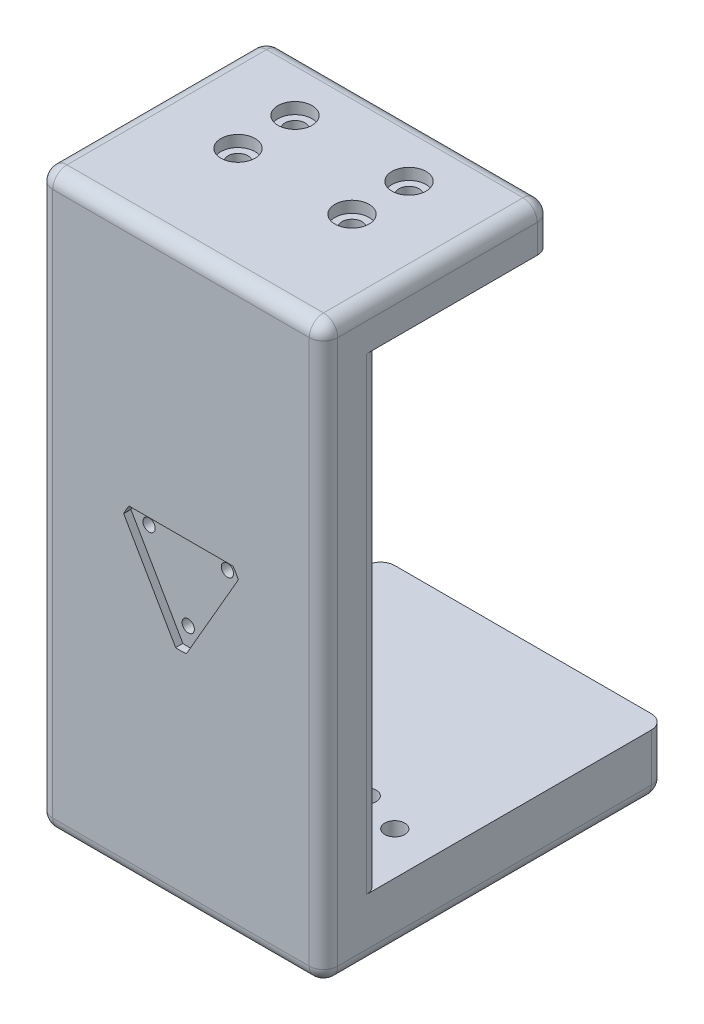
from build123d import *

# Parameters (mm, degrees)
SKETCH2_W           = 50
SKETCH2_H           = 20
BOSS_EXTRUDE1_DEPTH = 100
SKETCH3_R           = 3.5
CUT_EXTRUDE1_DEPTH  = 114.578166916
SKETCH4_W           = 50
SKETCH4_H           = 20
BOSS_EXTRUDE2_DEPTH = 201
SKETCH5_W           = 50
SKETCH5_H           = 15
BOSS_EXTRUDE3_DEPTH = 60
SKETCH6_R           = 3.5
CUT_EXTRUDE2_DEPTH  = 15
SKETCH7_R           = 6
CUT_EXTRUDE3_DEPTH  = 4
FILLET1_R           = 5
FILLET2_R           = 5
FILLET3_R           = 5
SKETCH15_R          = 6.35
BOSS_EXTRUDE5_DEPTH = 7.9375
MOVE_FACE1_BY       = 1.74
CUT_EXTRUDE9_START  = -7.9375
SKETCH17_R          = 6.35
CUT_EXTRUDE9_DEPTH  = 7.9375
SKETCH16_R          = 25
BOSS_EXTRUDE7_DEPTH = 2.54
SKETCH18_R          = 2.15
CUT_EXTRUDE10_DEPTH = 223.847481476
CUT_EXTRUDE11_START = -2.54
CUT_EXTRUDE11_DEPTH = 2.54
CUT_EXTRUDE12_START = -2.54
SKETCH20_R          = 25
CUT_EXTRUDE12_DEPTH = 2.54
SKETCH21_R          = 5
CUT_EXTRUDE13_DEPTH = 2


with BuildPart() as part:
    # Sketch2 → Boss-Extrude1 (new body)
    with BuildSketch(Plane.XY):
        with Locations((-25, -10)):
            Rectangle(SKETCH2_W, SKETCH2_H)
    boss_extrude1 = extrude(amount=-BOSS_EXTRUDE1_DEPTH)

    # Sketch3 → Cut-Extrude1 (cut, through all)
    with BuildSketch(Plane(origin=(0, 0, 0), x_dir=(1, 0, 0), z_dir=(0, 1, 0))):
        with Locations(Location((-20, 25, 0), (0, 0, 180))):
            Circle(SKETCH3_R)
        with Locations(Location((-35, 20, 0), (0, 0, 180))):
            Circle(SKETCH3_R)
    cut_extrude1 = extrude(amount=-CUT_EXTRUDE1_DEPTH, mode=Mode.SUBTRACT)

    # Sketch4 → Boss-Extrude2 (add)
    with BuildSketch(Plane.XZ.offset(20)):
        with Locations((-25, 10)):
            Rectangle(SKETCH4_W, SKETCH4_H)
    boss_extrude2 = extrude(amount=-BOSS_EXTRUDE2_DEPTH)

    # Sketch5 → Boss-Extrude3 (add)
    with BuildSketch(Plane(origin=(0, 0, 0), x_dir=(-1, 0, 0), z_dir=(0, 0, -1))):
        with Locations((25, 173.5)):
            Rectangle(SKETCH5_W, SKETCH5_H)
    boss_extrude3 = extrude(amount=BOSS_EXTRUDE3_DEPTH)

    # Sketch6 → Cut-Extrude2 (cut)
    with BuildSketch(Plane.XZ.offset(-166)):
        with Locations(Location((-20, -20, 0), (0, 0, 270))):
            Circle(SKETCH6_R)
        with Locations(Location((-20, -40, 0), (0, 0, 270))):
            Circle(SKETCH6_R)
    cut_extrude2 = extrude(amount=-CUT_EXTRUDE2_DEPTH, mode=Mode.SUBTRACT)

    # Sketch7 → Cut-Extrude3 (cut)
    with BuildSketch(Plane(origin=(0, 181, 0), x_dir=(1, 0, 0), z_dir=(0, 1, 0))):
        with Locations(Location((-20, 40, 0), (0, 0, 180))):
            Circle(SKETCH7_R)
        with Locations(Location((-20, 20, 0), (0, 0, 180))):
            Circle(SKETCH7_R)
    cut_extrude3 = extrude(amount=-CUT_EXTRUDE3_DEPTH, mode=Mode.SUBTRACT)

    # Mirror1: Boss-Extrude1, Cut-Extrude1, Boss-Extrude2, Boss-Extrude3, Cut-Extrude2, Cut-Extrude3 across plane
    add(boss_extrude1.mirror(Plane(origin=(0, 0, 0), x_dir=(0, 0, 1), z_dir=(1, 0, 0))))
    add(cut_extrude1.mirror(Plane(origin=(0, 0, 0), x_dir=(0, 0, 1), z_dir=(1, 0, 0))), mode=Mode.SUBTRACT)
    add(boss_extrude2.mirror(Plane(origin=(0, 0, 0), x_dir=(0, 0, 1), z_dir=(1, 0, 0))))
    add(boss_extrude3.mirror(Plane(origin=(0, 0, 0), x_dir=(0, 0, 1), z_dir=(1, 0, 0))))
    add(cut_extrude2.mirror(Plane(origin=(0, 0, 0), x_dir=(0, 0, 1), z_dir=(1, 0, 0))), mode=Mode.SUBTRACT)
    add(cut_extrude3.mirror(Plane(origin=(0, 0, 0), x_dir=(0, 0, 1), z_dir=(1, 0, 0))), mode=Mode.SUBTRACT)

    # Fillet1
    fillet1_edges = [part.edges().sort_by_distance(p)[0] for p in [
        (50, 173.5, -60),
        (-50, -10, -100),
        (0, -20, -100),
        (-50, 173.5, -60),
        (50, -20, -40),
        (50, -10, -100),
        (-50, -20, -40),
    ]]
    fillet(fillet1_edges, radius=FILLET1_R)

    # Fillet2
    fillet2_edges = [part.edges().sort_by_distance(p)[0] for p in [
        (50, 83, 0),
        (-50, 83, 0),
    ]]
    fillet(fillet2_edges, radius=FILLET2_R)

    # Fillet3
    fillet3_edges = [part.edges().sort_by_distance(p)[0] for p in [
        (0, -20, 20),
        (48.535533906, -18.535533906, 20),
        (-48.535533906, -18.535533906, 20),
        (0, 181, -60),
        (48.535533906, 181, -58.535533906),
        (-48.535533906, 181, -58.535533906),
        (-50, 181, -17.5),
        (0, 181, 20),
        (-50, 83, 20),
        (50, 83, 20),
        (50, 181, -17.5),
    ]]
    fillet(fillet3_edges, radius=FILLET3_R)

    # Sketch15 → Boss-Extrude5 (add)
    with BuildSketch(Plane.XY.offset(20)):
        with Locations((0, 80.5)):
            Circle(SKETCH15_R)
    extrude(amount=BOSS_EXTRUDE5_DEPTH)

    # Move Face1: a face moved outward by 1.74
    extrude(part.faces().sort_by_distance((0, 0, -50.320969635))[0], amount=MOVE_FACE1_BY, dir=(0, 1, 0))

    # Sketch17 → Cut-Extrude9 (cut)
    with BuildSketch(Plane.XY.offset(27.9375).offset(CUT_EXTRUDE9_START)):
        with Locations((0, 80.5)):
            Circle(SKETCH17_R)
    extrude(amount=CUT_EXTRUDE9_DEPTH, mode=Mode.SUBTRACT)

    # Sketch16 → Boss-Extrude7 (add)
    with BuildSketch(Plane.XY.offset(20)):
        with Locations((0, 80.5)):
            Circle(SKETCH16_R)
        with BuildLine():
            Line((-20.118015829, 89.945425564), (-1.879029427, 58.354574436))
            ThreePointArc((-1.879029427, 58.354574436), (0, 58.275), (1.879029427, 58.354574436))
            Line((1.879029427, 58.354574436), (20.118015829, 89.945425564))
            ThreePointArc((20.118015829, 89.945425564), (19.247414599, 91.6125), (18.238986403, 93.2))
            Line((18.238986403, 93.2), (-18.238986403, 93.2))
            ThreePointArc((-18.238986403, 93.2), (-19.247414599, 91.6125), (-20.118015829, 89.945425564))
        make_face(mode=Mode.SUBTRACT)
    extrude(amount=BOSS_EXTRUDE7_DEPTH)

    # Sketch18 → Cut-Extrude10 (cut, through all)
    with BuildSketch(Plane.XY.offset(20)):
        with Locations((0, 64.6275)):
            Circle(SKETCH18_R)
        with Locations((-13.748153285, 88.44)):
            Circle(SKETCH18_R)
        with Locations((13.748153285, 88.44)):
            Circle(SKETCH18_R)
    extrude(amount=-CUT_EXTRUDE10_DEPTH, mode=Mode.SUBTRACT)

    # Sketch19 → Cut-Extrude11 (cut)
    with BuildSketch(Plane.XY.offset(20).offset(CUT_EXTRUDE11_START)):
        with BuildLine():
            Line((-20.118015829, 89.945425564), (-1.879029427, 58.354574436))
            ThreePointArc((-1.879029427, 58.354574436), (0, 58.275), (1.879029427, 58.354574436))
            Line((1.879029427, 58.354574436), (20.118015829, 89.945425564))
            ThreePointArc((20.118015829, 89.945425564), (19.247414599, 91.6125), (18.238986403, 93.2))
            Line((18.238986403, 93.2), (-18.238986403, 93.2))
            ThreePointArc((-18.238986403, 93.2), (-19.247414599, 91.6125), (-20.118015829, 89.945425564))
        make_face()
    extrude(amount=CUT_EXTRUDE11_DEPTH, mode=Mode.SUBTRACT)

    # Sketch20 → Cut-Extrude12 (cut)
    with BuildSketch(Plane.XY.offset(22.54).offset(CUT_EXTRUDE12_START)):
        with Locations((0, 80.5)):
            Circle(SKETCH20_R)
    extrude(amount=CUT_EXTRUDE12_DEPTH, mode=Mode.SUBTRACT)

    # Sketch21 → Cut-Extrude13 (cut)
    with BuildSketch(Plane(origin=(0, 0, 0), x_dir=(-1, 0, 0), z_dir=(0, 0, -1))):
        with Locations((-13.748153285, 88.44)):
            Circle(SKETCH21_R)
        with Locations((13.748153285, 88.44)):
            Circle(SKETCH21_R)
        with Locations((0, 64.6275)):
            Circle(SKETCH21_R)
    extrude(amount=-CUT_EXTRUDE13_DEPTH, mode=Mode.SUBTRACT)


solid = part.part
